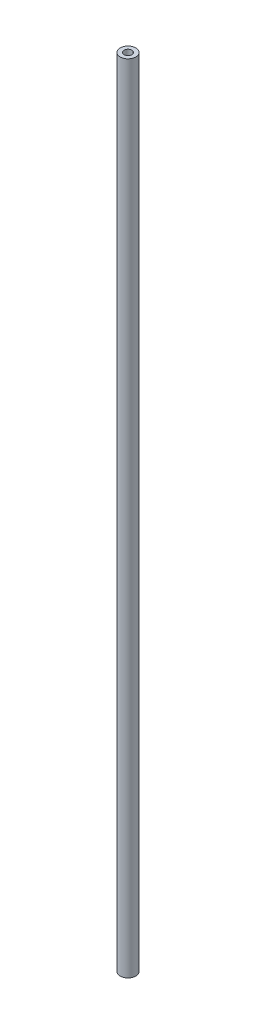
from build123d import *

# Parameters (mm, degrees)
SKETCH_1_R      = 3
SKETCH_1_R_2    = 1.5
EXTRUDE_1_DEPTH = 303.8


with BuildPart() as part:
    # 草图1 → 凸台-拉伸1 (new body)
    with BuildSketch(Plane(origin=(0, 0, 0), x_dir=(1, 0, 0), z_dir=(0, 1, 0))):
        with Locations(Location((0, 0, 0), (0, 0, 270))):
            Circle(SKETCH_1_R)
        with Locations(Location((0, 0, 0), (0, 0, 270))):
            Circle(SKETCH_1_R_2, mode=Mode.SUBTRACT)
    extrude(amount=EXTRUDE_1_DEPTH)


solid = part.part
